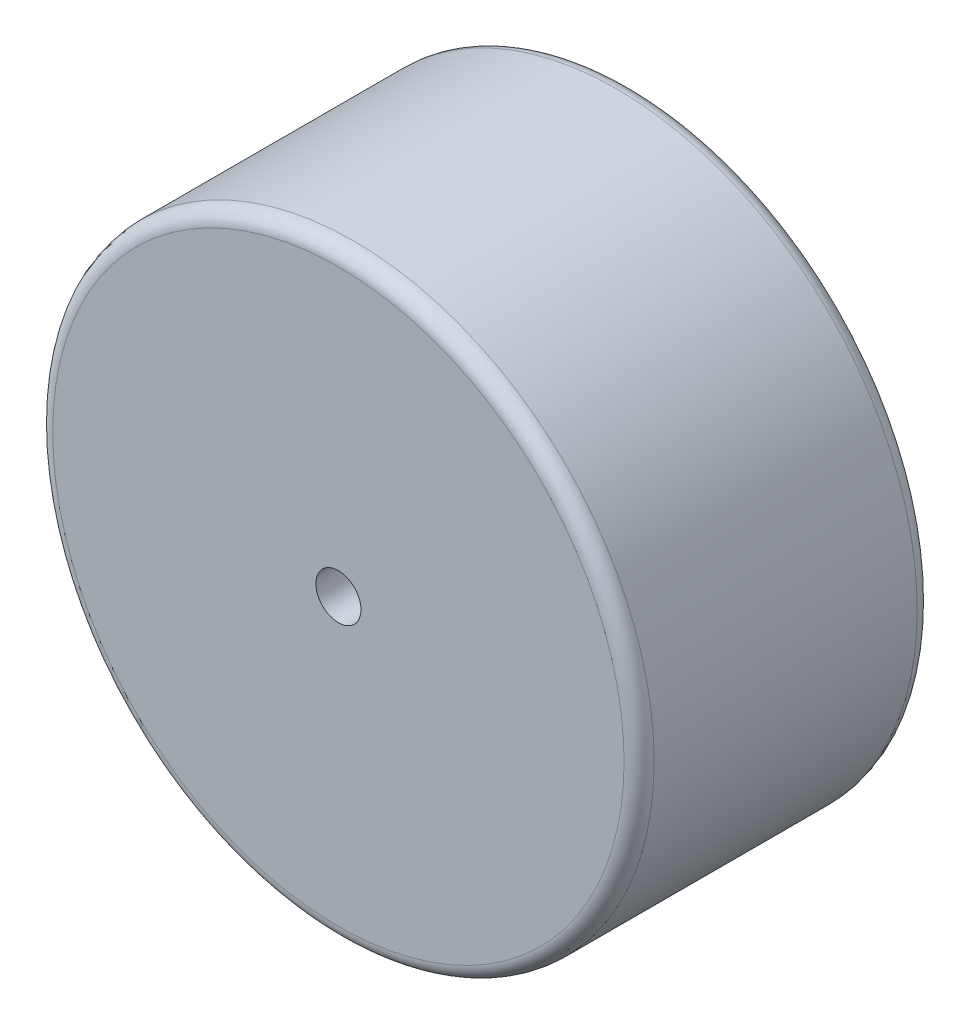
from build123d import *

# Parameters (mm, degrees)
SKETCH_1_R          = 20
EXTRUDE_1_DEPTH     = 19.5
FILLET_1_R          = 1
SKETCH_2_R          = 1.5
CUT_EXTRUDE_1_DEPTH = 20


with BuildPart() as part:
    # 草图1 → 凸台-拉伸1 (new body)
    with BuildSketch(Plane.XY):
        Circle(SKETCH_1_R)
    extrude(amount=EXTRUDE_1_DEPTH)

    # 圆角1
    fillet_1_edges = [part.edges().sort_by_distance(p)[0] for p in [
        (-20, 0, 0),
        (-20, 0, 19.5),
    ]]
    fillet(fillet_1_edges, radius=FILLET_1_R)

    # 草图2 → 切除-拉伸1 (cut)
    with BuildSketch(Plane.XY.offset(19.5)):
        Circle(SKETCH_2_R)
    extrude(amount=-CUT_EXTRUDE_1_DEPTH, mode=Mode.SUBTRACT)


solid = part.part
